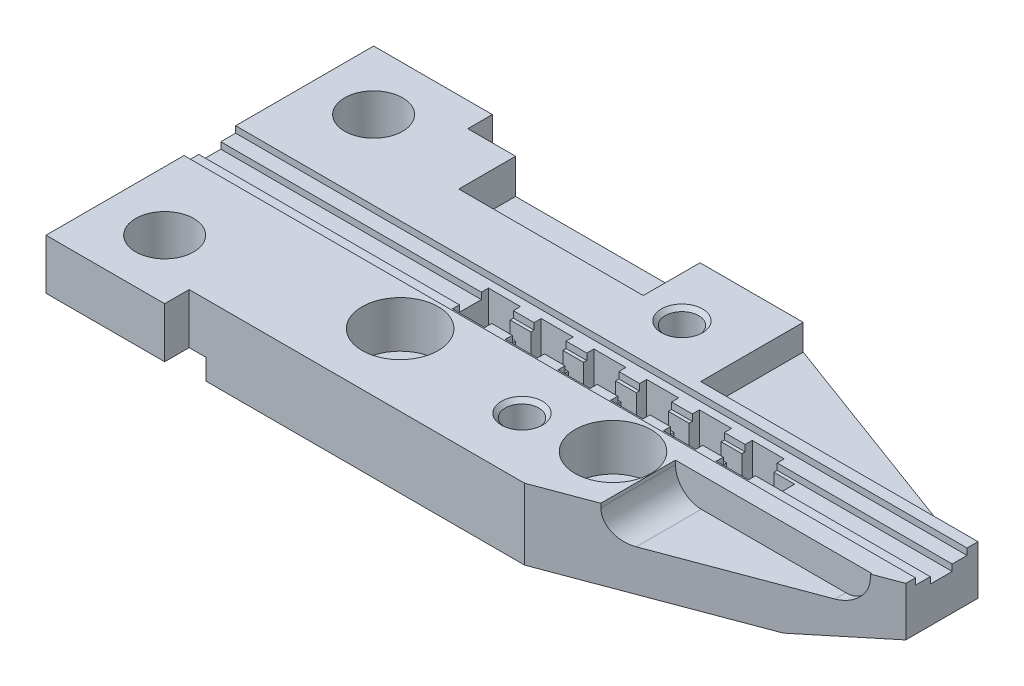
from build123d import *

# Parameters (mm, degrees)
SKETCH1_W           = 72.009
SKETCH1_H           = 6.985
BOSS_EXTRUDE1_DEPTH = 32.258
SKETCH2_W           = 13.335
SKETCH2_H           = 2.032
CUT_EXTRUDE1_DEPTH  = 75.682449945
SKETCH3_W           = 19.304
SKETCH3_H           = 2.921
CUT_EXTRUDE2_DEPTH  = 11.811
FILLET1_R           = 2.54
CUT_EXTRUDE3_DEPTH  = 75.682449945
SKETCH6_W           = 60.325
SKETCH6_H           = 2.413
CUT_EXTRUDE6_DEPTH  = 73.900474235
SKETCH11_W          = 18.161
SKETCH11_H          = 5.588
CUT_EXTRUDE7_DEPTH  = 3.429
SKETCH12_W          = 18.161
SKETCH12_H          = 3.175
CUT_EXTRUDE8_DEPTH  = 73.652144185
SKETCH13_W          = 30.314137033
SKETCH13_H          = 2.54
CUT_EXTRUDE9_DEPTH  = 10.0965
CUT_EXTRUDE10_DEPTH = 73.900474235
FILLET2_R           = 0.635
CUT_EXTRUDE11_DEPTH = 81.85576081
CUT_EXTRUDE12_DEPTH = 73.900474235
SKETCH18_R          = 0.758626194
SKETCH18_R_2        = 0.86735546
CUT_EXTRUDE13_DEPTH = 2.4765
SKETCH19_R          = 2.8575
CUT_EXTRUDE14_DEPTH = 73.733906314
CHAMFER1_SIZE       = 0.381
SKETCH20_R          = 1.651
CUT_EXTRUDE15_DEPTH = 73.900474235
CHAMFER2_SIZE       = 0.381
SKETCH21_R          = 2.159
CUT_EXTRUDE16_DEPTH = 73.900474235
SKETCH22_R          = 3.7465
CUT_EXTRUDE17_DEPTH = 4.572


with BuildPart() as part:
    # Sketch1 → Boss-Extrude1 (new body)
    with BuildSketch(Plane.XY):
        with Locations((-28.996348877, -14.164776435)):
            Rectangle(SKETCH1_W, SKETCH1_H)
    extrude(amount=-BOSS_EXTRUDE1_DEPTH)

    # Sketch2 → Cut-Extrude1 (cut, through all)
    with BuildSketch(Plane.XY):
        with Locations((-58.333348877, -16.641276435)):
            Rectangle(SKETCH2_W, SKETCH2_H)
    extrude(amount=-CUT_EXTRUDE1_DEPTH, mode=Mode.SUBTRACT)

    # Sketch3 → Cut-Extrude2 (cut)
    with BuildSketch(Plane.XY):
        with Locations((-5.183848877, -12.132776435)):
            Rectangle(SKETCH3_W, SKETCH3_H)
    extrude(amount=-CUT_EXTRUDE2_DEPTH, mode=Mode.SUBTRACT)

    # Fillet1
    fillet1_edges = [part.edges().sort_by_distance(p)[0] for p in [
        (-14.835848877, -13.593276435, -5.9055),
        (4.468151123, -13.593276435, -5.9055),
    ]]
    fillet(fillet1_edges, radius=FILLET1_R)

    # Sketch4 → Cut-Extrude3 (cut, through all)
    with BuildSketch(Plane.XY):
        Polygon((7.008151123, -17.657276435), (7.008151123, -15.498276435), (-1.754848877, -17.657276435), align=None)
    extrude(amount=-CUT_EXTRUDE3_DEPTH, mode=Mode.SUBTRACT)

    # Sketch6 → Cut-Extrude6 (cut, through all)
    with BuildSketch(Plane(origin=(0, -10.672276435, 0), x_dir=(1, 0, 0), z_dir=(0, 1, 0))):
        with Locations((-23.154348877, 31.0515)):
            Rectangle(SKETCH6_W, SKETCH6_H)
        with Locations((-23.154348877, 1.2065)):
            Rectangle(SKETCH6_W, SKETCH6_H)
    extrude(amount=-CUT_EXTRUDE6_DEPTH, mode=Mode.SUBTRACT)

    # Sketch11 → Cut-Extrude7 (cut)
    with BuildSketch(Plane(origin=(0, -10.672276435, 0), x_dir=(1, 0, 0), z_dir=(0, 1, 0))):
        with Locations((-39.537348877, 27.051)):
            Rectangle(SKETCH11_W, SKETCH11_H)
    extrude(amount=-CUT_EXTRUDE7_DEPTH, mode=Mode.SUBTRACT)

    # Sketch12 → Cut-Extrude8 (cut, through all)
    with BuildSketch(Plane(origin=(0, -14.101276435, 0), x_dir=(1, 0, 0), z_dir=(0, 1, 0))):
        with Locations((-39.537348877, 25.8445)):
            Rectangle(SKETCH12_W, SKETCH12_H)
    extrude(amount=-CUT_EXTRUDE8_DEPTH, mode=Mode.SUBTRACT)

    # Sketch13 → Cut-Extrude9 (cut)
    with BuildSketch(Plane(origin=(0, 0, -29.845), x_dir=(-1, 0, 0), z_dir=(0, 0, -1))):
        with Locations((5.139780361, -11.942276435)):
            Rectangle(SKETCH13_W, SKETCH13_H)
    extrude(amount=-CUT_EXTRUDE9_DEPTH, mode=Mode.SUBTRACT)

    # Sketch14 → Cut-Extrude10 (cut, through all)
    with BuildSketch(Plane(origin=(0, -10.672276435, 0), x_dir=(1, 0, 0), z_dir=(0, 1, 0))):
        Polygon((-20.296848877, 29.845), (7.008151123, 19.7485), (7.008151123, 29.845), align=None)
        Polygon((-20.296848877, 2.413), (7.008151123, 12.6365), (7.008151123, 2.413), align=None)
    extrude(amount=-CUT_EXTRUDE10_DEPTH, mode=Mode.SUBTRACT)

    # Fillet2
    fillet2_edges = [part.edges().sort_by_distance(p)[0] for p in [
        (-6.644348877, -13.212276435, -19.7485),
    ]]
    fillet(fillet2_edges, radius=FILLET2_R)

    # Sketch16 → Cut-Extrude11 (cut, through all)
    with BuildSketch(Plane.ZY.offset(65.000848877)):
        Polygon((-17.2085, -11.942276435), (-15.0495, -11.942276435), (-15.0495, -11.307276435), (-13.589, -11.307276435), (-13.589, -10.672276435), (-18.669, -10.672276435), (-18.669, -11.307276435), (-17.2085, -11.307276435), align=None)
    extrude(amount=-CUT_EXTRUDE11_DEPTH, mode=Mode.SUBTRACT)

    # Sketch17 → Cut-Extrude12 (cut, through all)
    with BuildSketch(Plane.XZ.offset(17.657276435)):
        Polygon((-31.002948877, -16.891), (-28.970948877, -16.891), (-28.958248877, -17.907), (-25.808648877, -17.907), (-25.808648877, -16.891), (-23.776648877, -16.891), (-23.763948877, -17.907), (-20.614348877, -17.907), (-20.614348877, -16.891), (-18.582348877, -16.891), (-18.569648877, -17.907), (-15.420048877, -17.907), (-15.420048877, -16.891), (-13.388048877, -16.891), (-13.375348877, -17.907), (-10.225748877, -17.907), (-10.225748877, -16.891), (-8.193748877, -16.891), (-8.168348877, -15.367), (-10.200348877, -15.367), (-10.200348877, -14.351), (-13.375348877, -14.351), (-13.362648877, -15.367), (-15.394648877, -15.367), (-15.394648877, -14.351), (-18.569648877, -14.351), (-18.556948877, -15.367), (-20.588948877, -15.367), (-20.588948877, -14.351), (-23.763948877, -14.351), (-23.751248877, -15.367), (-25.783248877, -15.367), (-25.783248877, -14.351), (-28.958248877, -14.351), (-28.945548877, -15.367), (-30.977548877, -15.367), (-30.977548877, -14.351), (-34.152548877, -14.351), (-34.139848877, -15.367), (-36.171848877, -15.367), (-36.171848877, -14.351), (-39.346848877, -14.351), (-39.346848877, -17.907), (-36.197248877, -17.907), (-36.197248877, -16.891), (-34.165248877, -16.891), (-34.152548877, -17.907), (-31.002948877, -17.907), align=None)
    extrude(amount=-CUT_EXTRUDE12_DEPTH, mode=Mode.SUBTRACT)

    # Sketch18 → Cut-Extrude13 (cut)
    with BuildSketch(Plane.XZ.offset(17.657276435)):
        with Locations((-8.829621314, -13.140704274)):
            Circle(SKETCH18_R)
        with Locations((-40.878405559, -14.788679648)):
            Circle(SKETCH18_R_2)
    extrude(amount=-CUT_EXTRUDE13_DEPTH, mode=Mode.SUBTRACT)

    # Sketch19 → Cut-Extrude14 (cut, through all)
    with BuildSketch(Plane.XZ.offset(15.625276435)):
        with Locations(Location((-59.158848877, -5.842, 0), (0, 0, 270))):
            Circle(SKETCH19_R)
        with Locations(Location((-59.158848877, -26.416, 0), (0, 0, 270))):
            Circle(SKETCH19_R)
    extrude(amount=-CUT_EXTRUDE14_DEPTH, mode=Mode.SUBTRACT)

    # Chamfer1
    chamfer1_edges = [part.edges().sort_by_distance(p)[0] for p in [
        (-59.158848877, -15.625276435, -2.9845),
        (-59.158848877, -15.625276435, -23.5585),
    ]]
    chamfer(chamfer1_edges, length=CHAMFER1_SIZE)

    # Sketch20 → Cut-Extrude15 (cut, through all)
    with BuildSketch(Plane.XZ.offset(17.657276435)):
        with Locations((-26.392848877, -8.255)):
            Circle(SKETCH20_R)
        with Locations((-26.392848877, -24.003)):
            Circle(SKETCH20_R)
    extrude(amount=-CUT_EXTRUDE15_DEPTH, mode=Mode.SUBTRACT)

    # Chamfer2
    chamfer2_edges = [part.edges().sort_by_distance(p)[0] for p in [
        (-28.043848877, -10.672276435, -8.255),
        (-28.043848877, -17.657276435, -8.255),
        (-28.043848877, -10.672276435, -24.003),
        (-28.043848877, -17.657276435, -24.003),
    ]]
    chamfer(chamfer2_edges, length=CHAMFER2_SIZE)

    # Sketch21 → Cut-Extrude16 (cut, through all)
    with BuildSketch(Plane.XZ.offset(17.657276435)):
        with Locations((-39.600848877, -9.468375809)):
            Circle(SKETCH21_R)
        with Locations((-18.645848877, -9.468375809)):
            Circle(SKETCH21_R)
    extrude(amount=-CUT_EXTRUDE16_DEPTH, mode=Mode.SUBTRACT)

    # Sketch22 → Cut-Extrude17 (cut)
    with BuildSketch(Plane(origin=(0, -10.672276435, 0), x_dir=(1, 0, 0), z_dir=(0, 1, 0))):
        with Locations(Location((-39.600848877, 9.468375809, 0), (0, 0, 270))):
            Circle(SKETCH22_R)
        with Locations(Location((-18.645848877, 9.468375809, 0), (0, 0, 270))):
            Circle(SKETCH22_R)
    extrude(amount=-CUT_EXTRUDE17_DEPTH, mode=Mode.SUBTRACT)


solid = part.part
